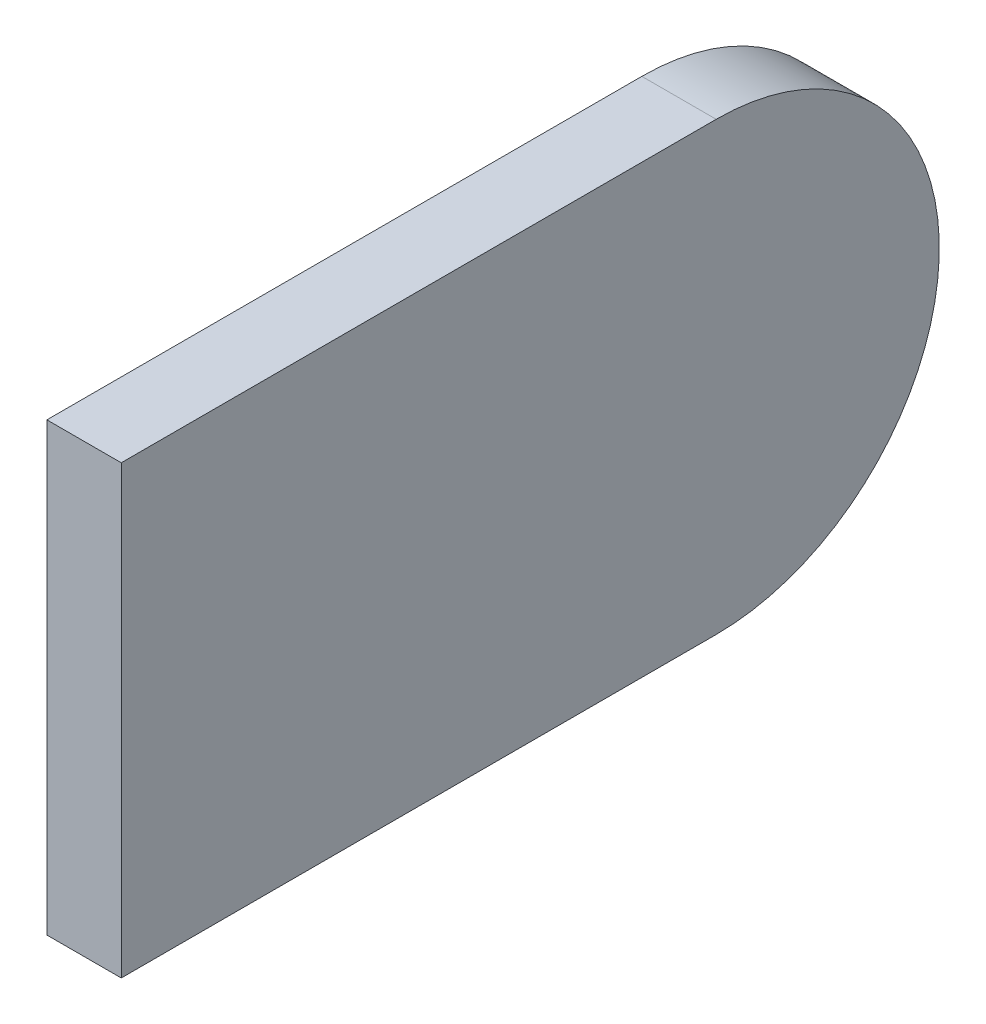
from build123d import *

# Parameters (mm, degrees)
BOSS_EXTRUDE1_DEPTH = 10


with BuildPart() as part:
    # Sketch2 → Boss-Extrude1 (new body)
    with BuildSketch(Plane(origin=(0, 0, 0), x_dir=(0, 0, -1), z_dir=(1, 0, 0))):
        with BuildLine():
            Line((0, 0), (80, 0))
            ThreePointArc((80, 0), (110, 30), (80, 60))
            Line((80, 60), (0, 60))
            Line((0, 60), (0, 0))
        make_face()
    extrude(amount=BOSS_EXTRUDE1_DEPTH)


solid = part.part
